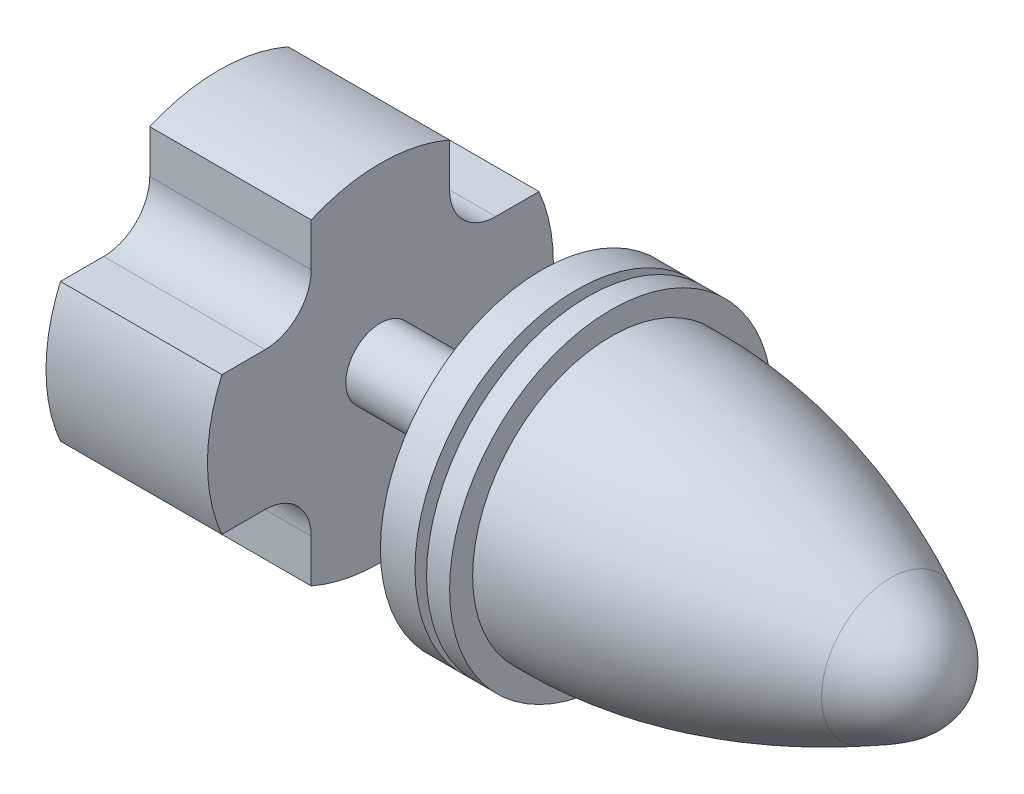
from build123d import *

# Parameters (mm, degrees)
ENL_V_START             = -10
ENL_V_MAT_EXTRU_1_DEPTH = 10


with BuildPart() as part:
    # Esquisse1 → Révolution1 (revolve)
    with BuildSketch(Plane.XY):
        with BuildLine():
            Line((38.667823993, 0), (38.667823993, 1.585))
            Line((38.667823993, 1.585), (36.667823993, 1.585))
            Line((36.667823993, 1.585), (33.667823993, 4.585))
            Line((33.667823993, 4.585), (33.667823993, 7.5))
            Line((33.667823993, 7.5), (40.667823993, 7.5))
            Line((40.667823993, 7.5), (40.667823993, 1.5))
            Line((40.667823993, 1.5), (47.667823993, 1.5))
            Line((47.667823993, 1.5), (47.667823993, 7))
            Line((47.667823993, 7), (49.167823993, 7))
            Line((49.167823993, 7), (49.167823993, 1.5))
            Line((49.167823993, 1.5), (49.667823993, 1.5))
            Line((49.667823993, 1.5), (49.667823993, 7))
            Line((49.667823993, 7), (50.667823993, 7))
            Line((50.667823993, 7), (50.667823993, 6))
            add(Edge.make_bspline(
                [(50.667823993, 6), (54.792010738, 6.082824703), (58.901540934, 4.911130099), (62.781307834, 2.984328023)],
                knots=[0, 0, 0, 0, 1, 1, 1, 1], degree=3))
            add(Edge.make_bspline(
                [(62.781307834, 2.984328023), (64.265948318, 2.24701353), (65.473917032, 1.727596368), (65.667823993, 0)],
                knots=[0, 0, 0, 0, 1, 1, 1, 1], degree=3))
            Line((65.667823993, 0), (38.667823993, 0))
        make_face()
    revolve(axis=Axis((0, 0, 0), (1, 0, 0)))

    # Esquisse2 → Enlèv. mat.-Extru.1 (cut)
    with BuildSketch(Plane.ZY.offset(-33.667823993).offset(ENL_V_START)):
        with BuildLine():
            ThreePointArc((6.873863542, 3), (5.303300859, 5.303300859), (3, 6.873863542))
            Line((3, 6.873863542), (3, 5))
            ThreePointArc((3, 5), (3.585786438, 3.585786438), (5, 3))
            Line((5, 3), (6.873863542, 3))
        make_face()
        with BuildLine():
            Line((-3, 5), (-3, 6.873863542))
            ThreePointArc((-3, 6.873863542), (-5.303300859, 5.303300859), (-6.873863542, 3))
            Line((-6.873863542, 3), (-5, 3))
            ThreePointArc((-5, 3), (-3.585786438, 3.585786438), (-3, 5))
        make_face()
        with BuildLine():
            ThreePointArc((3, -6.873863542), (5.303300859, -5.303300859), (6.873863542, -3))
            Line((6.873863542, -3), (5, -3))
            ThreePointArc((5, -3), (3.585786438, -3.585786438), (3, -5))
            Line((3, -5), (3, -6.873863542))
        make_face()
        with BuildLine():
            Line((-5, -3), (-6.873863542, -3))
            ThreePointArc((-6.873863542, -3), (-5.303300859, -5.303300859), (-3, -6.873863542))
            Line((-3, -6.873863542), (-3, -5))
            ThreePointArc((-3, -5), (-3.585786438, -3.585786438), (-5, -3))
        make_face()
    extrude(amount=ENL_V_MAT_EXTRU_1_DEPTH, mode=Mode.SUBTRACT)


solid = part.part
